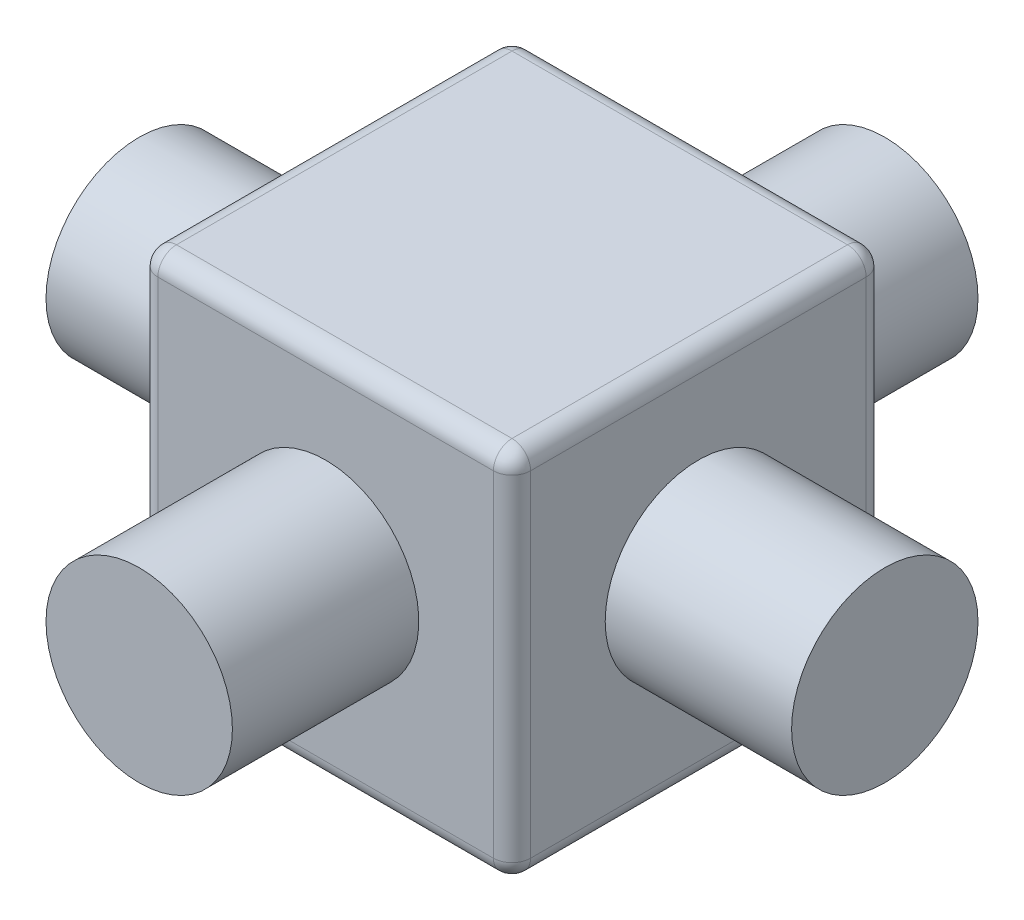
from build123d import *

# Parameters (mm, degrees)
SKETCH1_W           = 6
SKETCH1_H           = 6
BOSS_EXTRUDE1_DEPTH = 6
FILLET1_R           = 0.3
SKETCH2_R           = 1.5
BOSS_EXTRUDE2_DEPTH = 3
CIRPATTERN1_COUNT   = 4


with BuildPart() as part:
    # Sketch1 → Boss-Extrude1 (new body)
    with BuildSketch(Plane(origin=(0, 0, 0), x_dir=(1, 0, 0), z_dir=(0, 1, 0))):
        Rectangle(SKETCH1_W, SKETCH1_H)
    extrude(amount=BOSS_EXTRUDE1_DEPTH)

    # Fillet1
    fillet1_edges = [part.edges().sort_by_distance(p)[0] for p in [
        (-3, 0, 0),
        (-3, 3, -3),
        (0, 0, -3),
        (3, 3, -3),
        (3, 0, 0),
        (-3, 3, 3),
        (3, 3, 3),
        (0, 0, 3),
        (0, 6, 3),
        (-3, 6, 0),
        (0, 6, -3),
        (3, 6, 0),
    ]]
    fillet(fillet1_edges, radius=FILLET1_R)

    # Sketch2 → Boss-Extrude2 (add)
    with BuildSketch(Plane(origin=(0, 0, -3), x_dir=(-1, 0, 0), z_dir=(0, 0, -1))):
        with Locations((0, 3)):
            Circle(SKETCH2_R)
    boss_extrude2 = extrude(amount=BOSS_EXTRUDE2_DEPTH)

    # CirPattern1: Boss-Extrude2 ×4 about axis
    cirpattern1_axis = Axis((0, 0.03, 0), (0, 1, 0))
    for i in range(1, CIRPATTERN1_COUNT):
        add(boss_extrude2.rotate(cirpattern1_axis, i * 360 / CIRPATTERN1_COUNT))


solid = part.part
